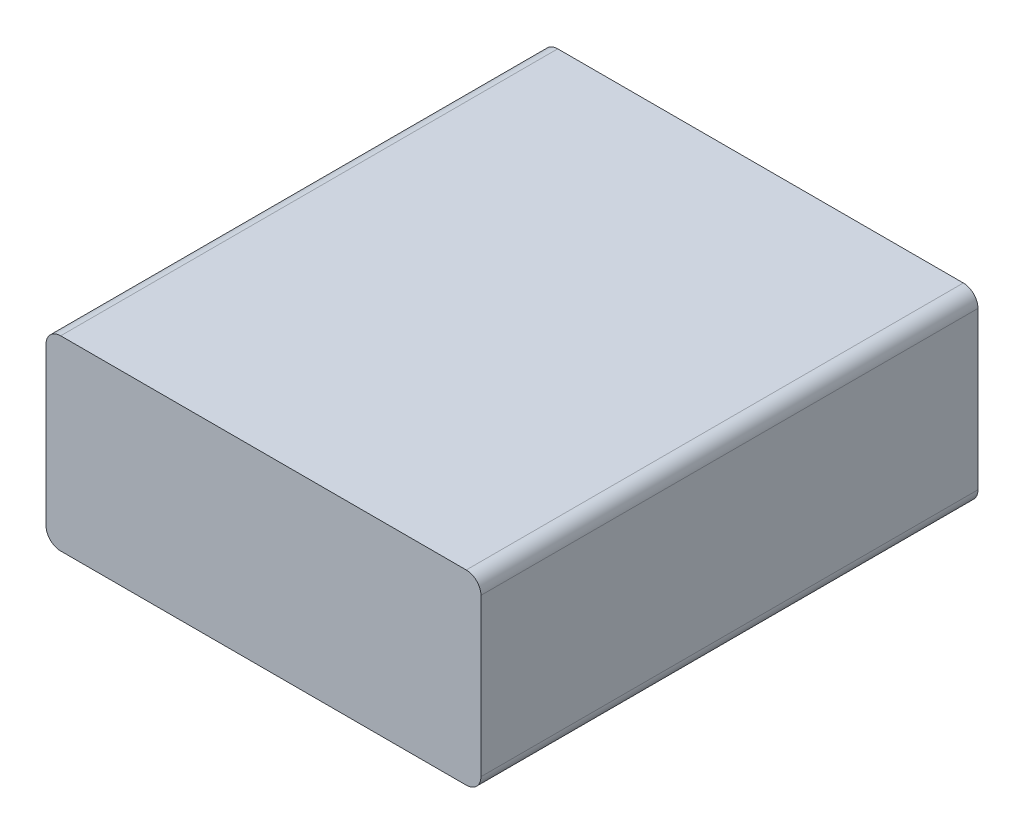
from build123d import *

# Parameters (mm, degrees)
BOSS_EXTRUDE1_DEPTH = 101.6


with BuildPart() as part:
    # Sketch1 → Boss-Extrude1 (new body)
    with BuildSketch(Plane.XY):
        with BuildLine():
            Line((41.45, -19.05), (-41.45, -19.05))
            ThreePointArc((-41.45, -19.05), (-43.571320344, -18.171320344), (-44.45, -16.05))
            Line((-44.45, -16.05), (-44.45, 16.05))
            ThreePointArc((-44.45, 16.05), (-43.571320344, 18.171320344), (-41.45, 19.05))
            Line((-41.45, 19.05), (41.45, 19.05))
            ThreePointArc((41.45, 19.05), (43.571320344, 18.171320344), (44.45, 16.05))
            Line((44.45, 16.05), (44.45, -16.05))
            ThreePointArc((44.45, -16.05), (43.571320344, -18.171320344), (41.45, -19.05))
        make_face()
    extrude(amount=BOSS_EXTRUDE1_DEPTH)


solid = part.part
